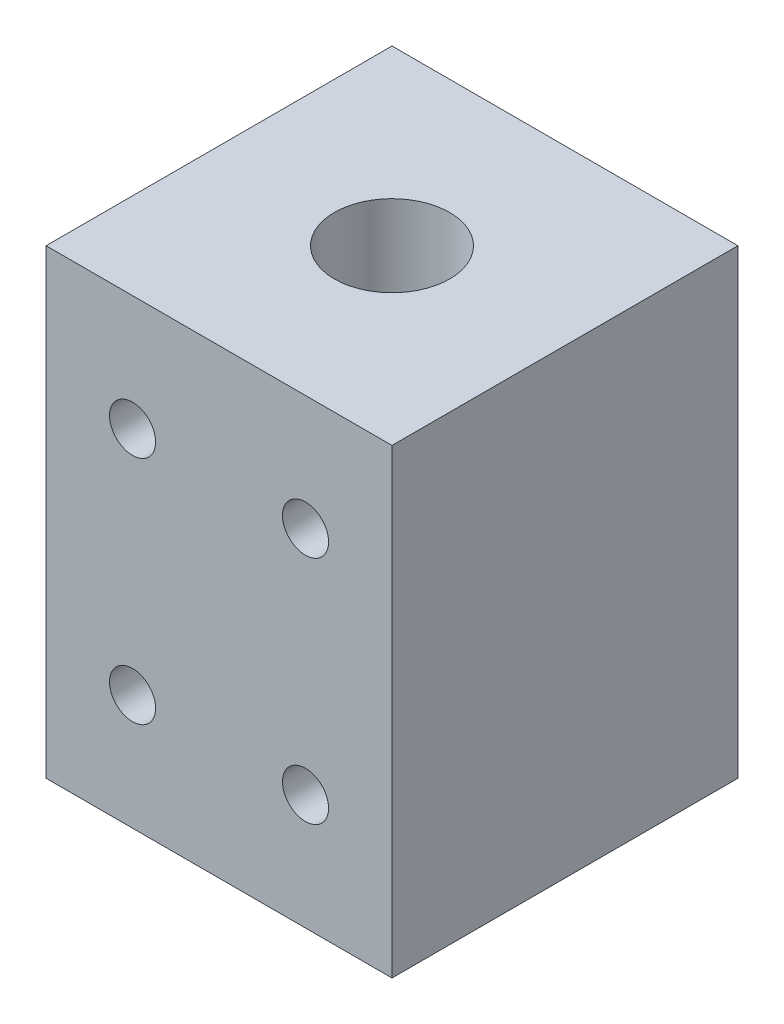
from build123d import *

# Parameters (mm, degrees)
CROQUIS1_W              = 60
CROQUIS1_H              = 60
CROQUIS1_R              = 10
SALIENTE_EXTRUIR1_DEPTH = 80
CROQUIS2_R              = 4
CORTAR_EXTRUIR1_DEPTH   = 20


with BuildPart() as part:
    # Croquis1 → Saliente-Extruir1 (new body)
    with BuildSketch(Plane(origin=(0, 0, 0), x_dir=(1, 0, 0), z_dir=(0, 1, 0))):
        Rectangle(CROQUIS1_W, CROQUIS1_H)
        with Locations(Location((0, 0, 0), (0, 0, 270))):
            Circle(CROQUIS1_R, mode=Mode.SUBTRACT)
    extrude(amount=SALIENTE_EXTRUIR1_DEPTH)

    # Croquis2 → Cortar-Extruir1 (cut)
    with BuildSketch(Plane.XY.offset(30)):
        with Locations((-15, 60)):
            Circle(CROQUIS2_R)
        with Locations((15, 60)):
            Circle(CROQUIS2_R)
        with Locations((-15, 20)):
            Circle(CROQUIS2_R)
        with Locations((15, 20)):
            Circle(CROQUIS2_R)
    extrude(amount=-CORTAR_EXTRUIR1_DEPTH, mode=Mode.SUBTRACT)


solid = part.part
